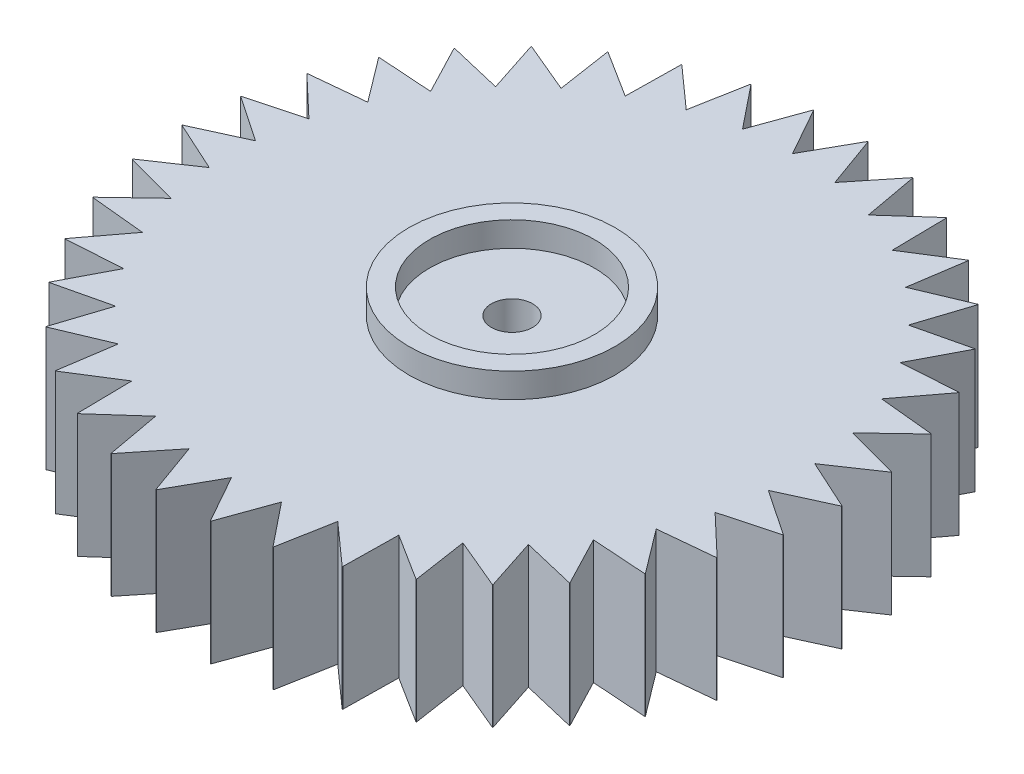
from build123d import *

# Parameters (mm, degrees)
CROQUIS1_R                   = 40
SALIENTE_EXTRUIR1_DEPTH      = 15
CORTAR_EXTRUIR3_START        = -55
CORTAR_EXTRUIR3_DEPTH        = 75
MATRIZC1_COUNT               = 38
SALIENTE_EXTRUIR2_DEPTH      = 18
SALIENTE_EXTRUIR2_DEPTH_BACK = 3
CROQUIS4_R                   = 12.5
CROQUIS4_R_2                 = 10
CORTAR_EXTRUIR4_DEPTH        = 26
CORTAR_EXTRUIR4_DEPTH_BACK   = 41
CROQUIS5_R                   = 2.5


with BuildPart() as part:
    # Croquis1 → Saliente-Extruir1 (new body)
    with BuildSketch(Plane(origin=(0, 0, 0), x_dir=(1, 0, 0), z_dir=(0, 1, 0))):
        with Locations(Location((0, 0, 0), (0, 0, 270))):
            Circle(CROQUIS1_R)
    extrude(amount=SALIENTE_EXTRUIR1_DEPTH)

    # Croquis2 → Cortar-Extruir3 (cut)
    with BuildSketch(Plane(origin=(0, 0, 0), x_dir=(1, 0, 0), z_dir=(0, 1, 0)).offset(CORTAR_EXTRUIR3_START)):
        Polygon((0, 34.025968572), (3.276888375, 39.865549069), (0, 41.704379346), (-3.276888375, 39.865549069), align=None)
    cortar_extruir3 = extrude(amount=CORTAR_EXTRUIR3_DEPTH, mode=Mode.SUBTRACT)

    # MatrizC1: Cortar-Extruir3 ×38 about axis
    matrizc1_axis = Axis((0, 0, 0), (0, 1, 0))
    for i in range(1, MATRIZC1_COUNT):
        add(cortar_extruir3.rotate(matrizc1_axis, i * 360 / MATRIZC1_COUNT), mode=Mode.SUBTRACT)

    # Croquis4 → Saliente-Extruir2 (add, two sides: drawn at the far end of the back side and taken through both)
    with BuildSketch(Plane(origin=(0, 0, 0), x_dir=(1, 0, 0), z_dir=(0, 1, 0)).offset(-SALIENTE_EXTRUIR2_DEPTH_BACK)):
        with Locations(Location((0, 0, 0), (0, 0, 270))):
            Circle(CROQUIS4_R)
        with Locations(Location((0, 0, 0), (0, 0, 270))):
            Circle(CROQUIS4_R_2, mode=Mode.SUBTRACT)
    extrude(amount=SALIENTE_EXTRUIR2_DEPTH + SALIENTE_EXTRUIR2_DEPTH_BACK)

    # Croquis5 → Cortar-Extruir4 (cut, two sides: drawn at the far end of the back side and taken through both)
    with BuildSketch(Plane(origin=(0, 0, 0), x_dir=(1, 0, 0), z_dir=(0, 1, 0)).offset(-CORTAR_EXTRUIR4_DEPTH_BACK)):
        with Locations(Location((0, 0, 0), (0, 0, 270))):
            Circle(CROQUIS5_R)
    extrude(amount=CORTAR_EXTRUIR4_DEPTH + CORTAR_EXTRUIR4_DEPTH_BACK, mode=Mode.SUBTRACT)


solid = part.part
